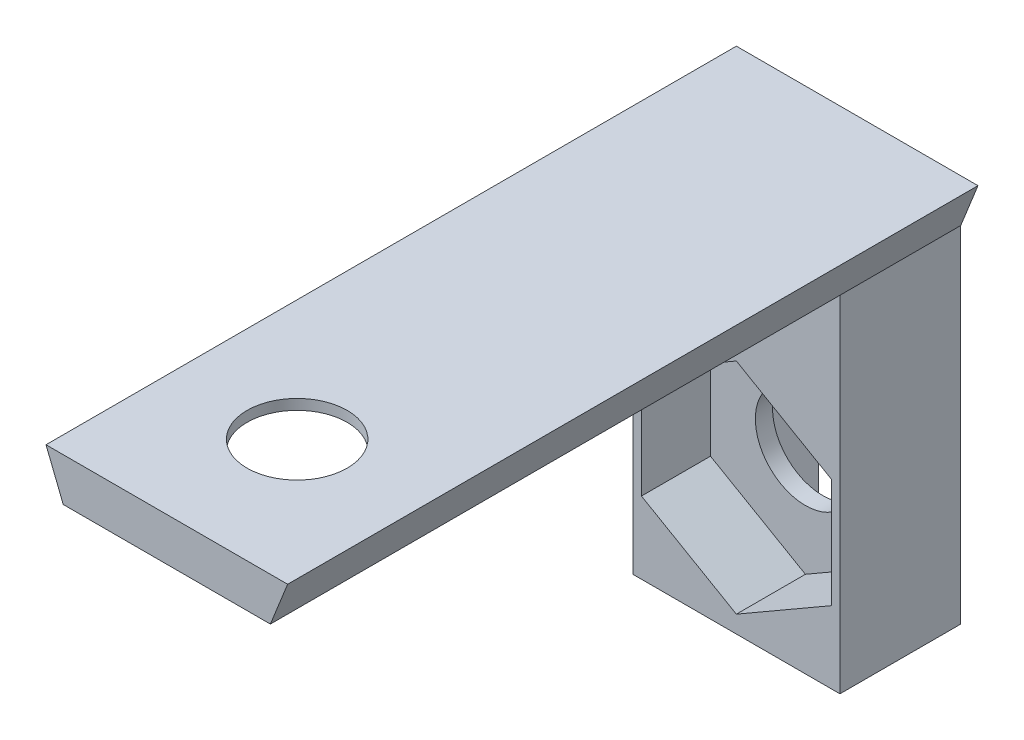
from build123d import *

# Parameters (mm, degrees)
SKETCH1_W           = 12
SKETCH1_H           = 7
BOSS_EXTRUDE1_DEPTH = 20
CUT_EXTRUDE1_DEPTH  = 20
CUT_EXTRUDE2_REACH  = 24.023
SKETCH3_R           = 2.9
CUT_EXTRUDE3_DEPTH  = 4
SKETCH5_W           = 14
SKETCH5_H           = 40
BOSS_EXTRUDE2_DEPTH = 2.5
CUT_EXTRUDE4_REACH  = 48.425
CUT_EXTRUDE6_DEPTH  = 1.9
CUT_EXTRUDE7_REACH  = 45.138
SKETCH9_R           = 2.9


with BuildPart() as part:
    # Sketch1 → Boss-Extrude1 (new body)
    with BuildSketch(Plane(origin=(0, 0, 0), x_dir=(1, 0, 0), z_dir=(0, 1, 0))):
        Rectangle(SKETCH1_W, SKETCH1_H)
    extrude(amount=BOSS_EXTRUDE1_DEPTH)

    # Sketch2 → Cut-Extrude1 (cut)
    with BuildSketch(Plane(origin=(0, 20, 0), x_dir=(1, 0, 0), z_dir=(0, 1, 0))):
        Polygon((0, 3.5), (2.25, 3.5), (4.25, 1.5), (0, 1.5), (-4.25, 1.5), (-2.25, 3.5), align=None)
    extrude(amount=-CUT_EXTRUDE1_DEPTH, mode=Mode.SUBTRACT)

    # Sketch3 → Cut-Extrude2 (cut, up to next)
    with BuildSketch(Plane.XY.offset(3.5), mode=Mode.PRIVATE) as cut_extrude2_sk1:
        with Locations((0, 7.35)):
            Circle(SKETCH3_R)
    cut_extrude2_tool1 = extrude(cut_extrude2_sk1.sketch, amount=-CUT_EXTRUDE2_REACH, mode=Mode.PRIVATE) & part.part
    add(cut_extrude2_tool1.solids().sort_by_distance((0, 7.35, 3.5))[0], mode=Mode.SUBTRACT)

    # Sketch4 → Cut-Extrude3 (cut)
    with BuildSketch(Plane.XY.offset(3.5)):
        Polygon((0, 13.700852961), (-5.5, 10.525426481), (-5.5, 4.174573519), (0, 0.999147039), (5.5, 4.174573519), (5.5, 10.525426481), align=None)
    extrude(amount=-CUT_EXTRUDE3_DEPTH, mode=Mode.SUBTRACT)

    # Sketch5 → Boss-Extrude2 (add)
    with BuildSketch(Plane(origin=(0, 20, 0), x_dir=(1, 0, 0), z_dir=(0, 1, 0))):
        with Locations((0, -16.5)):
            Rectangle(SKETCH5_W, SKETCH5_H)
    extrude(amount=BOSS_EXTRUDE2_DEPTH)

    # Sketch6 → Cut-Extrude4 (cut, up to next)
    with BuildSketch(Plane(origin=(0, 0, -3.5), x_dir=(-1, 0, 0), z_dir=(0, 0, -1)), mode=Mode.PRIVATE) as cut_extrude4_sk1:
        Polygon((-7, 20), (-7, 22.5), (-6, 20), align=None)
    cut_extrude4_tool1 = extrude(cut_extrude4_sk1.sketch, amount=-CUT_EXTRUDE4_REACH, mode=Mode.PRIVATE) & part.part
    # Sketch6 → Cut-Extrude4 (cut, up to next)
    with BuildSketch(Plane(origin=(0, 0, -3.5), x_dir=(-1, 0, 0), z_dir=(0, 0, -1)), mode=Mode.PRIVATE) as cut_extrude4_sk2:
        Polygon((7, 20), (6, 20), (7, 22.5), align=None)
    cut_extrude4_tool2 = extrude(cut_extrude4_sk2.sketch, amount=-CUT_EXTRUDE4_REACH, mode=Mode.PRIVATE) & part.part
    add(cut_extrude4_tool1.solids().sort_by_distance((6.666667, 20.833333, -3.5))[0], mode=Mode.SUBTRACT)
    add(cut_extrude4_tool2.solids().sort_by_distance((-6.666667, 20.833333, -3.5))[0], mode=Mode.SUBTRACT)

    # Sketch8 → Cut-Extrude6 (cut)
    with BuildSketch(Plane.XZ.offset(-20)):
        Polygon((0, 22.599147039), (5.5, 25.774573519), (5.5, 32.125426481), (0, 35.300852961), (-5.5, 32.125426481), (-5.5, 25.774573519), align=None)
    extrude(amount=-CUT_EXTRUDE6_DEPTH, mode=Mode.SUBTRACT)

    # Sketch9 → Cut-Extrude7 (cut, up to next)
    with BuildSketch(Plane(origin=(0, 21.9, 0), x_dir=(-1, 0, 0), z_dir=(0, -1, 0)), mode=Mode.PRIVATE) as cut_extrude7_sk1:
        with Locations(Location((0, -28.95, 0), (0, 0, 90))):
            Circle(SKETCH9_R)
    cut_extrude7_tool1 = extrude(cut_extrude7_sk1.sketch, amount=-CUT_EXTRUDE7_REACH, mode=Mode.PRIVATE) & part.part
    add(cut_extrude7_tool1.solids().sort_by_distance((0, 21.9, 28.95))[0], mode=Mode.SUBTRACT)


solid = part.part
